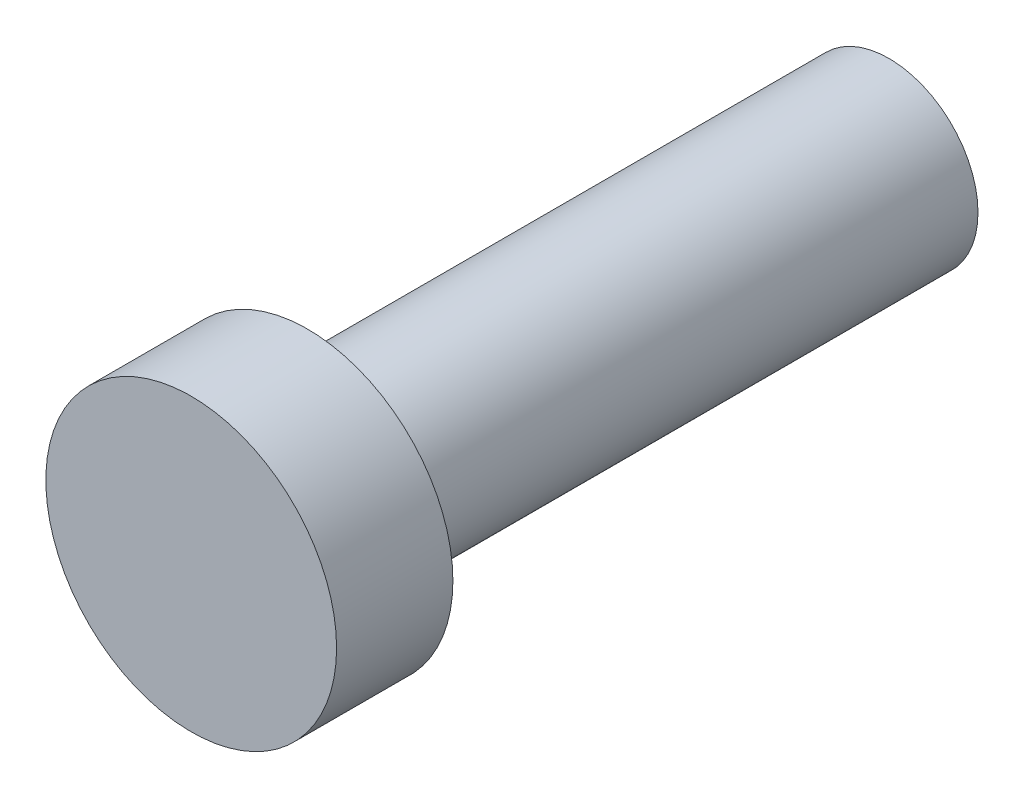
from build123d import *

# Parameters (mm, degrees)
SKETCH_2_R      = 1.53
EXTRUDE_1_DEPTH = 10
SKETCH_11_R     = 2.5
EXTRUDE_2_DEPTH = 2


with BuildPart() as part:
    # 스케치2 → 보스-돌출1 (new body)
    with BuildSketch(Plane.XY):
        Circle(SKETCH_2_R)
    extrude(amount=EXTRUDE_1_DEPTH)

    # 스케치11 → 보스-돌출2 (add)
    with BuildSketch(Plane.XY.offset(10)):
        Circle(SKETCH_11_R)
    extrude(amount=EXTRUDE_2_DEPTH)


solid = part.part
